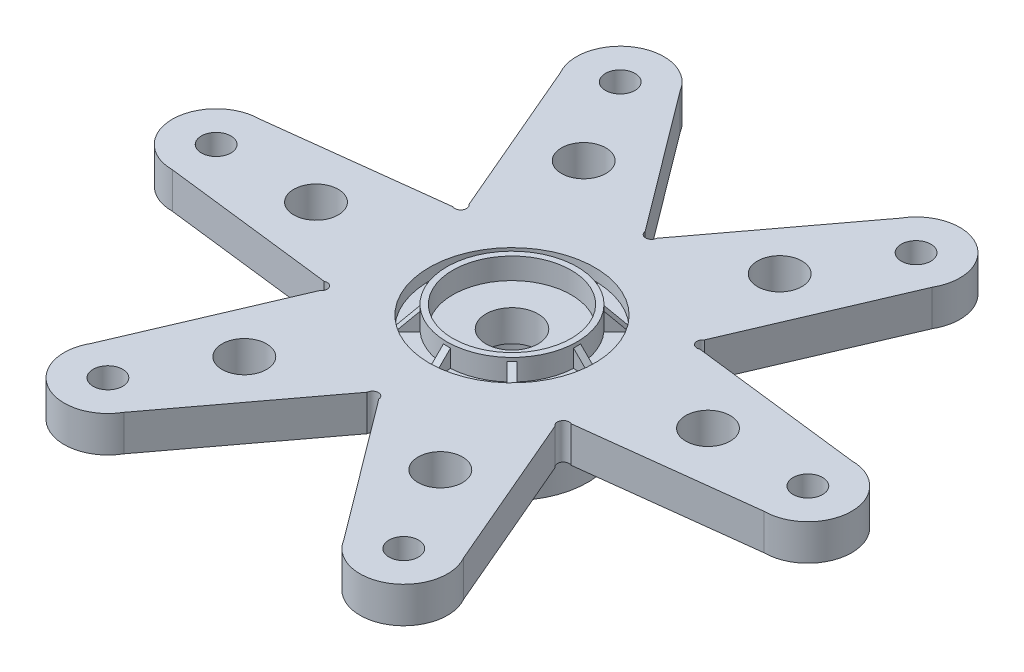
from build123d import *

# Parameters (mm, degrees)
EXTRUDE4_DEPTH          = 1.9304
SKETCH2_R               = 0.6604
CUT_EXTRUDE1_DEPTH      = 19.722050478
CIRPATTERN4_COUNT       = 6
CUT_EXTRUDE2_DEPTH      = 12.7
CUT_EXTRUDE2_DEPTH_BACK = 12.7
SKETCH3_R               = 1.397
SKETCH4_R               = 4.445
CUT_EXTRUDE3_DEPTH      = 0.635
SKETCH5_R               = 3.4925
SKETCH5_R_2             = 3.175
EXTRUDE5_DEPTH          = 1.143
RIB10_REACH             = 26.438
SKETCH8_WALL_W          = 52.220152264
SKETCH8_WALL_H          = 0.381
CIRPATTERN5_COUNT       = 8
SKETCH9_R               = 0.79375
SKETCH9_R_2             = 1.1938
CUT_EXTRUDE4_DEPTH      = 25.392925761
CIRPATTERN6_COUNT       = 6
SKETCH10_R              = 5.08
EXTRUDE6_DEPTH          = 0.762
FILLET2_R               = 0.508
SKETCH11_R              = 4.064
EXTRUDE7_DEPTH          = 3.048
FILLET3_R               = 0.889
SKETCH12_R              = 2.8575
CUT_EXTRUDE5_DEPTH      = 3.429
SKETCH14_R              = 1.397
CUT_EXTRUDE6_DEPTH      = 25.557003564
SKETCH15_R              = 0.3175
CUT_EXTRUDE7_DEPTH      = 25.984806887
CIRPATTERN7_COUNT       = 6


with BuildPart() as part:
    # Sketch1 → Extrude4 (new body)
    with BuildSketch(Plane(origin=(0, 0, 0), x_dir=(1, 0, 0), z_dir=(0, 1, 0))):
        with BuildLine():
            Line((5.775220615, -3.829827046), (0, 0))
            Line((0, 0), (5.775220615, 3.829827046))
            Line((5.775220615, 3.829827046), (6.35029977, 3.829827046))
            Line((6.35029977, 3.829827046), (6.35029977, 3.494998084))
            Line((6.35029977, 3.494998084), (15.87469147, 2.35207108))
            ThreePointArc((15.87469147, 2.35207108), (18.22419147, 0.00257108), (15.87469147, -2.34692892))
            Line((15.87469147, -2.34692892), (6.34969147, -3.48992892))
            Line((6.34969147, -3.48992892), (6.34969147, -3.829827046))
            Line((6.34969147, -3.829827046), (5.775220615, -3.829827046))
        make_face()
    extrude4 = extrude(amount=EXTRUDE4_DEPTH)

    # Sketch2 → Cut-Extrude1 (cut, through all)
    with BuildSketch(Plane(origin=(0, 1.9304, 0), x_dir=(-1, 0, 0), z_dir=(0, 1, 0))):
        with Locations((-6.342552501, -4.149920748)):
            Circle(SKETCH2_R)
        with Locations((-6.342552501, 4.149920748)):
            Circle(SKETCH2_R)
    extrude(amount=-CUT_EXTRUDE1_DEPTH, mode=Mode.SUBTRACT)

    # CirPattern4: Extrude4 ×6 about axis
    cirpattern4_axis = Axis((0, 0, 0), (0, 1, 0))
    for i in range(1, CIRPATTERN4_COUNT):
        add(extrude4.rotate(cirpattern4_axis, i * 360 / CIRPATTERN4_COUNT))

    # Sketch3 → Cut-Extrude2 (cut, two sides: drawn at the far end of the back side and taken through both)
    with BuildSketch(Plane(origin=(0, 1.9304, 0), x_dir=(-1, 0, 0), z_dir=(0, 1, 0)).offset(-CUT_EXTRUDE2_DEPTH_BACK)):
        Circle(SKETCH3_R)
    extrude(amount=CUT_EXTRUDE2_DEPTH + CUT_EXTRUDE2_DEPTH_BACK, mode=Mode.SUBTRACT)

    # Sketch4 → Cut-Extrude3 (cut)
    with BuildSketch(Plane(origin=(0, 1.9304, 0), x_dir=(-1, 0, 0), z_dir=(0, 1, 0))):
        Circle(SKETCH4_R)
    extrude(amount=-CUT_EXTRUDE3_DEPTH, mode=Mode.SUBTRACT)

    # Sketch5 → Extrude5 (add)
    with BuildSketch(Plane(origin=(0, 1.2954, 0), x_dir=(-1, 0, 0), z_dir=(0, 1, 0))):
        Circle(SKETCH5_R)
        Circle(SKETCH5_R_2, mode=Mode.SUBTRACT)
    extrude(amount=EXTRUDE5_DEPTH)

    # Sketch8 wall → Rib10 (add, up to next)
    with BuildSketch(Plane(origin=(-3.967749561, 1.770078976, 0), x_dir=(-0.70753138537, -0.706681921883, 0), z_dir=(0.706681921883, -0.70753138537, 0)), mode=Mode.PRIVATE) as rib10_sk1:
        Rectangle(SKETCH8_WALL_W, SKETCH8_WALL_H)
    rib10_tool1 = extrude(rib10_sk1.sketch, amount=RIB10_REACH, mode=Mode.PRIVATE) - part.part
    rib10 = rib10_tool1.solids().sort_by_distance((-3.967749561, 1.770078976, 0))[0]
    add(rib10)

    # CirPattern5: Rib10 ×8 about axis
    cirpattern5_axis = Axis((0, 0, 0), (0, 1, 0))
    for i in range(1, CIRPATTERN5_COUNT):
        add(rib10.rotate(cirpattern5_axis, i * 360 / CIRPATTERN5_COUNT))

    # Sketch9 → Cut-Extrude4 (cut, through all)
    with BuildSketch(Plane(origin=(0, 1.9304, 0), x_dir=(-1, 0, 0), z_dir=(0, 1, 0))):
        with Locations((7.935119114, 13.749171631)):
            Circle(SKETCH9_R)
        with Locations((5.256324989, 9.107628175)):
            Circle(SKETCH9_R_2)
    cut_extrude4 = extrude(amount=-CUT_EXTRUDE4_DEPTH, mode=Mode.SUBTRACT)

    # CirPattern6: Cut-Extrude4 ×6 about axis
    cirpattern6_axis = Axis((0, 0, 0), (0, 1, 0))
    for i in range(1, CIRPATTERN6_COUNT):
        add(cut_extrude4.rotate(cirpattern6_axis, i * 360 / CIRPATTERN6_COUNT), mode=Mode.SUBTRACT)

    # Sketch10 → Extrude6 (add)
    with BuildSketch(Plane.XZ):
        Circle(SKETCH10_R)
    extrude(amount=EXTRUDE6_DEPTH)

    # Fillet2
    fillet2_edges = [part.edges().sort_by_distance(p)[0] for p in [
        (-5.08, 0, 0),
    ]]
    fillet(fillet2_edges, radius=FILLET2_R)

    # Sketch11 → Extrude7 (add)
    with BuildSketch(Plane.XZ.offset(0.762)):
        Circle(SKETCH11_R)
    extrude(amount=EXTRUDE7_DEPTH)

    # Fillet3
    fillet3_edges = [part.edges().sort_by_distance(p)[0] for p in [
        (-4.064, -0.762, 0),
    ]]
    fillet(fillet3_edges, radius=FILLET3_R)

    # Sketch12 → Cut-Extrude5 (cut)
    with BuildSketch(Plane.XZ.offset(3.81)):
        Circle(SKETCH12_R)
    extrude(amount=-CUT_EXTRUDE5_DEPTH, mode=Mode.SUBTRACT)

    # Sketch14 → Cut-Extrude6 (cut, through all)
    with BuildSketch(Plane.XZ.offset(0.381)):
        Circle(SKETCH14_R)
    extrude(amount=-CUT_EXTRUDE6_DEPTH, mode=Mode.SUBTRACT)

    # Sketch15 → Cut-Extrude7 (cut, symmetric)
    with BuildSketch(Plane(origin=(0, 1.9304, 0), x_dir=(-1, 0, 0), z_dir=(0, 1, 0))):
        with Locations((-6.48724684, -3.751940905)):
            Circle(SKETCH15_R)
    cut_extrude7 = extrude(amount=CUT_EXTRUDE7_DEPTH, both=True, mode=Mode.SUBTRACT)

    # CirPattern7: Cut-Extrude7 ×6 about axis
    cirpattern7_axis = Axis((0, 0, 0), (0, 1, 0))
    for i in range(1, CIRPATTERN7_COUNT):
        add(cut_extrude7.rotate(cirpattern7_axis, i * 360 / CIRPATTERN7_COUNT), mode=Mode.SUBTRACT)


solid = part.part
